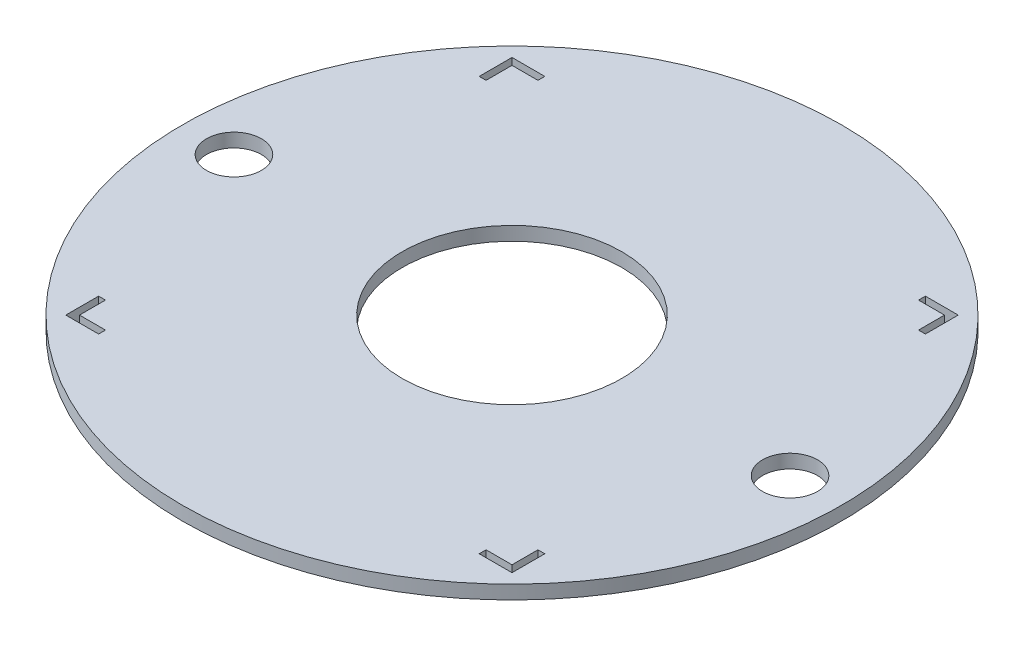
from build123d import *

# Parameters (mm, degrees)
SKETCH1_R           = 76.2
BOSS_EXTRUDE1_DEPTH = 3.175
SKETCH2_R           = 25.4
CUT_EXTRUDE1_DEPTH  = 3.175
SKETCH3_R           = 6.35
CUT_EXTRUDE2_DEPTH  = 10


with BuildPart() as part:
    # Sketch1 → Boss-Extrude1 (new body)
    with BuildSketch(Plane(origin=(0, 0, 0), x_dir=(1, 0, 0), z_dir=(0, 1, 0))):
        with Locations(Location((0, 0, 0), (0, 0, 270))):
            Circle(SKETCH1_R)
        Polygon((-50, 50), (-50, 44), (-51.5875, 44), (-51.5875, 51.5875), (-44, 51.5875), (-44, 50), align=None, mode=Mode.SUBTRACT)
        Polygon((51.5875, -44), (50, -44), (50, -50), (44, -50), (44, -51.5875), (51.5875, -51.5875), align=None, mode=Mode.SUBTRACT)
        Polygon((-50, -50), (-44, -50), (-44, -51.5875), (-51.5875, -51.5875), (-51.5875, -44), (-50, -44), align=None, mode=Mode.SUBTRACT)
        Polygon((51.5875, 51.5875), (44, 51.5875), (44, 50), (50, 50), (50, 44), (51.5875, 44), align=None, mode=Mode.SUBTRACT)
    extrude(amount=BOSS_EXTRUDE1_DEPTH)

    # Sketch2 → Cut-Extrude1 (cut)
    with BuildSketch(Plane(origin=(0, 3.175, 0), x_dir=(1, 0, 0), z_dir=(0, 1, 0))):
        with Locations(Location((0, 0, 0), (0, 0, 270))):
            Circle(SKETCH2_R)
    extrude(amount=-CUT_EXTRUDE1_DEPTH, mode=Mode.SUBTRACT)

    # Sketch3 → Cut-Extrude2 (cut)
    with BuildSketch(Plane(origin=(0, 3.175, 0), x_dir=(1, 0, 0), z_dir=(0, 1, 0))):
        with Locations(Location((-64.2875, 0, 0), (0, 0, 270))):
            Circle(SKETCH3_R)
        with Locations(Location((64.2875, 0, 0), (0, 0, 270))):
            Circle(SKETCH3_R)
    extrude(amount=-CUT_EXTRUDE2_DEPTH, mode=Mode.SUBTRACT)


solid = part.part
